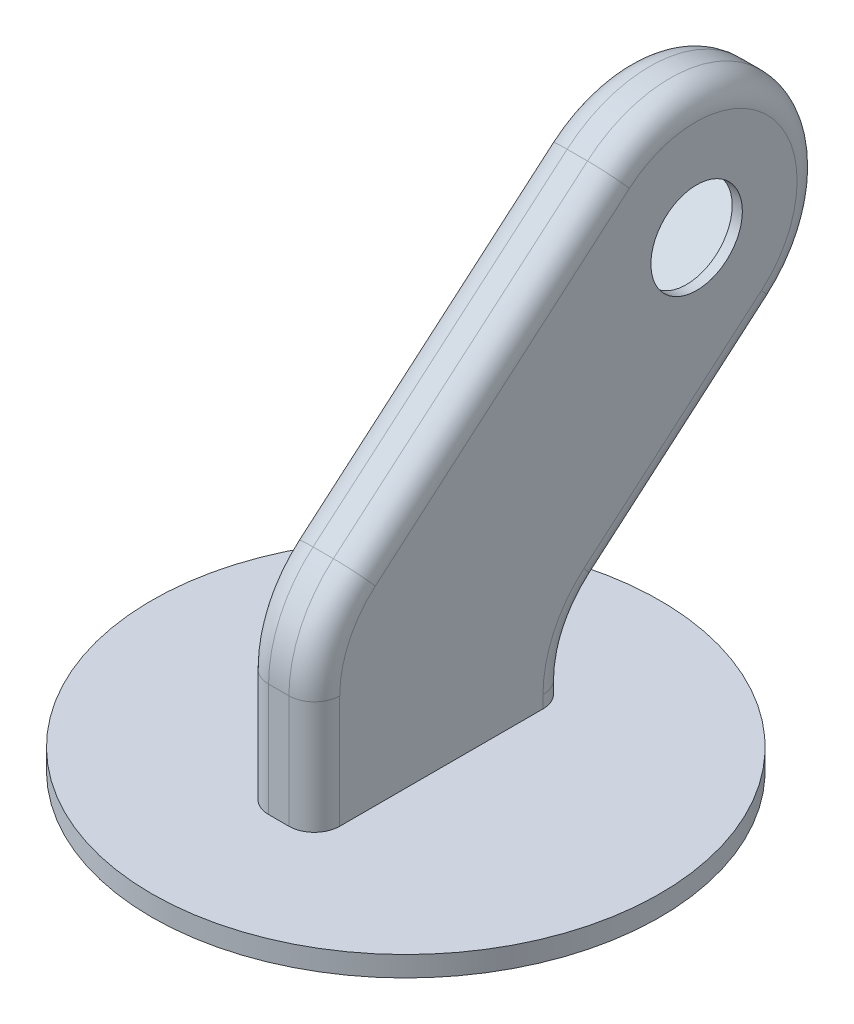
from build123d import *

# Parameters (mm, degrees)
SKETCH2_R            = 50
BOSS_EXTRUDE1_DEPTH  = 4
BOSS_EXTRUDE2_DEPTH  = 14
CUT_EXTRUDE5_REACH   = 134.235
SKETCH30_R           = 20
BOSS_EXTRUDE12_DEPTH = 5
SKETCH5_R            = 2.5
CUT_EXTRUDE18_DEPTH  = 5
SKETCH4_R            = 1.5
CUT_EXTRUDE19_DEPTH  = 5
SKETCH9_R            = 2
CUT_EXTRUDE6_DEPTH   = 7.5
FILLET7_R            = 5
CUT_EXTRUDE20_DEPTH  = 1.5
SKETCH32_R           = 9
CUT_EXTRUDE21_DEPTH  = 10


with BuildPart() as part:
    # Sketch2 → Boss-Extrude1 (new body)
    with BuildSketch(Plane(origin=(0, 0, 0), x_dir=(1, 0, 0), z_dir=(0, 1, 0))):
        with Locations(Location((0, 0, 0), (0, 0, 270))):
            Circle(SKETCH2_R)
    extrude(amount=BOSS_EXTRUDE1_DEPTH)

    # Sketch7 → Boss-Extrude2 (add)
    with BuildSketch(Plane(origin=(7, 0, 0), x_dir=(0, 0, -1), z_dir=(1, 0, 0))):
        with BuildLine():
            Line((25, 4), (25, 6.428793809))
            ThreePointArc((25, 6.428793809), (26.650688088, 13.958734048), (31.3, 20.107609548))
            Line((31.3, 20.107609548), (66.25, 50.001644808))
            ThreePointArc((66.25, 50.001644808), (68.998355192, 85.25), (33.75, 87.998355192))
            Line((33.75, 87.998355192), (-16.25, 45.23149502))
            ThreePointArc((-16.25, 45.23149502), (-22.707377656, 36.691390159), (-25, 26.233139828))
            Line((-25, 26.233139828), (-25, 4))
            Line((-25, 4), (25, 4))
        make_face()
    extrude(amount=-BOSS_EXTRUDE2_DEPTH)

    # Sketch8 → Cut-Extrude5 (cut, up to next)
    with BuildSketch(Plane(origin=(5, 0, 0), x_dir=(0, 0, -1), z_dir=(1, 0, 0)), mode=Mode.PRIVATE) as cut_extrude5_sk1:
        Polygon((20.224986928, 57.349309181), (51.382289443, 83.999309181), (65.032289443, 68.040690819), (33.874986928, 41.390690819), align=None)
    cut_extrude5_tool1 = extrude(cut_extrude5_sk1.sketch, amount=-CUT_EXTRUDE5_REACH, mode=Mode.PRIVATE) & part.part
    add(cut_extrude5_tool1.solids().sort_by_distance((5, 62.695, -42.628638))[0], mode=Mode.SUBTRACT)

    # Sketch30 → Boss-Extrude12 (add)
    with BuildSketch(Plane.XZ):
        with Locations(Location((0, 0, 0), (0, 0, 270))):
            Circle(SKETCH30_R)
    extrude(amount=BOSS_EXTRUDE12_DEPTH)

    # Sketch5 → Cut-Extrude18 (cut)
    with BuildSketch(Plane.XZ):
        with Locations(Location((0, 0, 0), (0, 0, 270))):
            Circle(SKETCH5_R)
    extrude(amount=CUT_EXTRUDE18_DEPTH, mode=Mode.SUBTRACT)

    # Sketch4 → Cut-Extrude19 (cut)
    with BuildSketch(Plane.XZ):
        with Locations(Location((0, 6, 0), (0, 0, 270))):
            Circle(SKETCH4_R)
        with Locations(Location((0, -6, 0), (0, 0, 270))):
            Circle(SKETCH4_R)
    extrude(amount=CUT_EXTRUDE19_DEPTH, mode=Mode.SUBTRACT)

    # Sketch9 → Cut-Extrude6 (cut)
    with BuildSketch(Plane.ZY.offset(7)):
        with Locations((-65.028980219, 75.275328962)):
            Circle(SKETCH9_R)
        with Locations((-20.228296152, 50.114671038)):
            Circle(SKETCH9_R)
        with Locations((-26.728296152, 42.515328962)):
            Circle(SKETCH9_R)
        with Locations((-58.528980219, 82.874671038)):
            Circle(SKETCH9_R)
    extrude(amount=-CUT_EXTRUDE6_DEPTH, mode=Mode.SUBTRACT)

    # Fillet7
    fillet7_edges = [part.edges().sort_by_distance(p)[0] for p in [
        (-7, 35.054627178, -48.775),
        (7, 85.25, -68.998355192),
        (7, 66.614925106, -8.75),
        (-7, 85.25, -68.998355192),
        (-7, 13.958734048, -26.650688088),
        (-7, 5.214396905, -25),
        (-7, 15.116569914, 25),
        (-7, 66.614925106, -8.75),
        (-7, 36.691390159, 22.707377656),
        (7, 36.691390159, 22.707377656),
        (7, 35.054627178, -48.775),
        (7, 15.116569914, 25),
        (7, 5.214396905, -25),
        (7, 13.958734048, -26.650688088),
    ]]
    fillet(fillet7_edges, radius=FILLET7_R)

    # Sketch31 → Cut-Extrude20 (cut)
    with BuildSketch(Plane.ZY.offset(7)):
        Polygon((-14.525480371, 52.474309181), (-28.175480371, 36.515690819), (-70.731796001, 72.915690819), (-57.081796001, 88.874309181), align=None)
    extrude(amount=-CUT_EXTRUDE20_DEPTH, mode=Mode.SUBTRACT)

    # Sketch32 → Cut-Extrude21 (cut)
    with BuildSketch(Plane(origin=(7, 0, 0), x_dir=(0, 0, -1), z_dir=(1, 0, 0))):
        with Locations((50.227980262, 69.195)):
            Circle(SKETCH32_R)
    extrude(amount=-CUT_EXTRUDE21_DEPTH, mode=Mode.SUBTRACT)


solid = part.part
